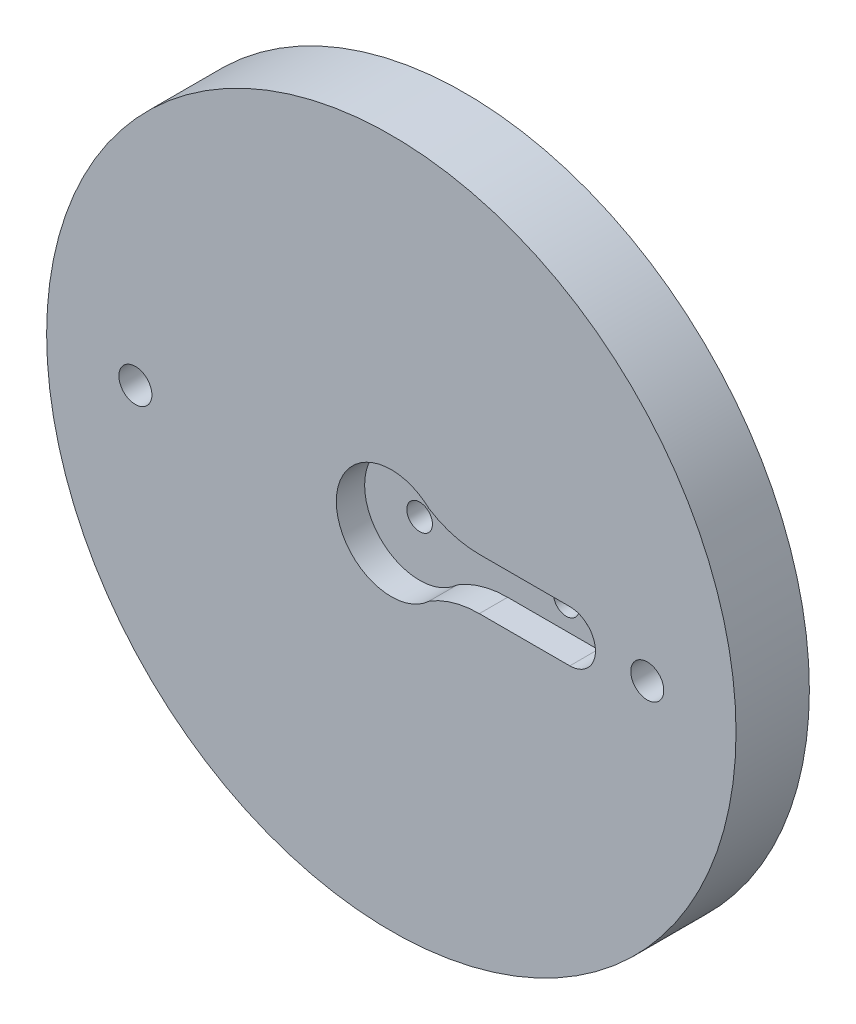
from build123d import *

# Parameters (mm, degrees)
SKETCH1_R           = 47
SKETCH1_R_2         = 2.25
BOSS_EXTRUDE1_DEPTH = 10
CUT_EXTRUDE1_DEPTH  = 3.86
SKETCH3_R           = 1.75
CUT_EXTRUDE2_DEPTH  = 67.751026958


with BuildPart() as part:
    # Sketch1 → Boss-Extrude1 (new body)
    with BuildSketch(Plane(origin=(0, 0, 0), x_dir=(0, 1, 0), z_dir=(0, 0, 1))):
        with Locations(Location((0, 0, 0), (0, 0, 270))):
            Circle(SKETCH1_R)
        with Locations(Location((0, 34.897005385, 0), (0, 0, 270))):
            Circle(SKETCH1_R_2, mode=Mode.SUBTRACT)
        with Locations(Location((0, -34.897005385, 0), (0, 0, 90))):
            Circle(SKETCH1_R_2, mode=Mode.SUBTRACT)
    extrude(amount=BOSS_EXTRUDE1_DEPTH)

    # Sketch2 → Cut-Extrude1 (cut)
    with BuildSketch(Plane.XY.offset(10)):
        with BuildLine():
            Line((24.33053856, 3.5), (12, 3.5))
            ThreePointArc((12, 3.5), (8.440790603, 3.996719292), (5.153570125, 5.448918697))
            ThreePointArc((5.153570125, 5.448918697), (-7.5, 0), (5.153570125, -5.448918697))
            ThreePointArc((5.153570125, -5.448918697), (8.440790603, -3.996719292), (12, -3.5))
            Line((12, -3.5), (24.33053856, -3.5))
            ThreePointArc((24.33053856, -3.5), (27.83053856, 0), (24.33053856, 3.5))
        make_face()
    extrude(amount=-CUT_EXTRUDE1_DEPTH, mode=Mode.SUBTRACT)

    # Sketch3 → Cut-Extrude2 (cut, through all)
    with BuildSketch(Plane.XY.offset(6.14)):
        Circle(SKETCH3_R)
        with Locations((20, 0)):
            Circle(SKETCH3_R)
        with Locations((24, 0)):
            Circle(SKETCH3_R)
    extrude(amount=-CUT_EXTRUDE2_DEPTH, mode=Mode.SUBTRACT)


solid = part.part
